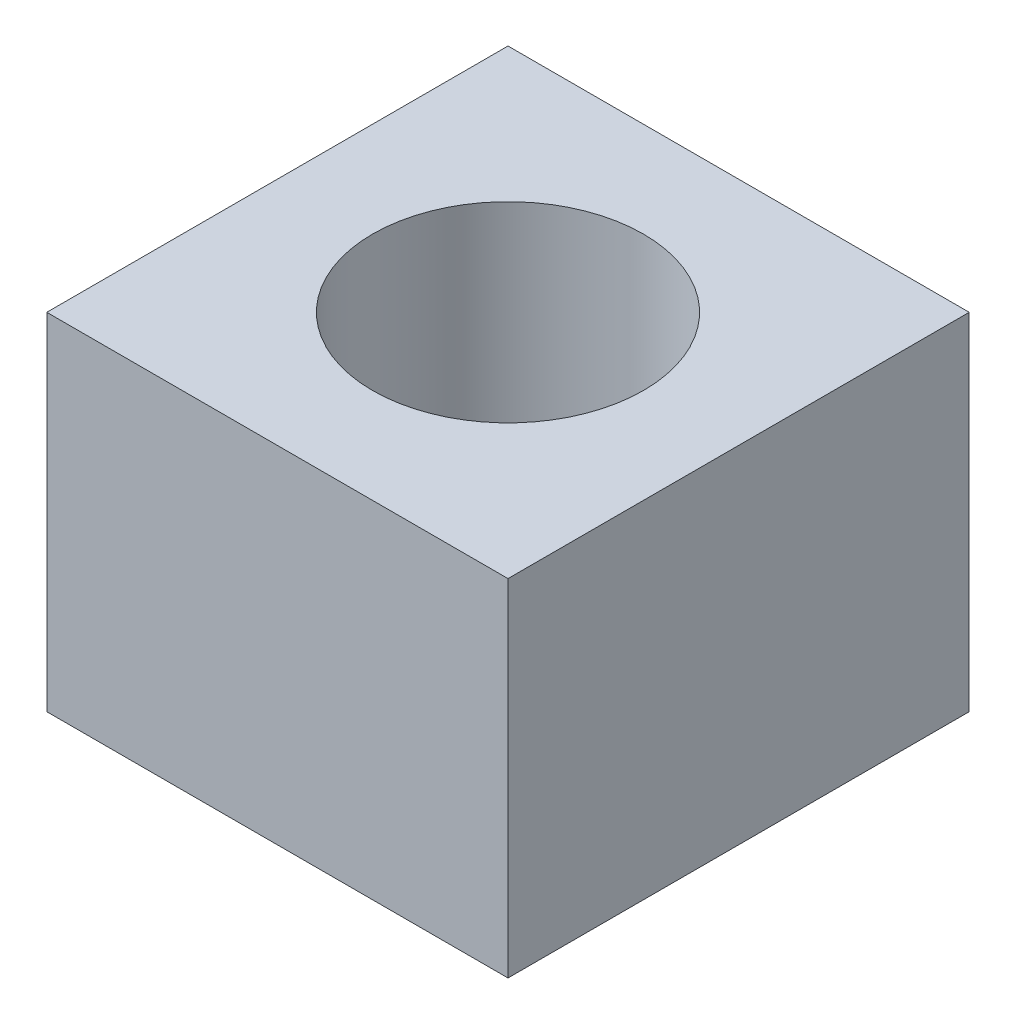
from build123d import *

# Parameters (mm, degrees)
SKETCH1_W           = 80
SKETCH1_H           = 80
BOSS_EXTRUDE1_DEPTH = 60
SKETCH2_R           = 23.5
CUT_EXTRUDE1_DEPTH  = 44.2


with BuildPart() as part:
    # Sketch1 → Boss-Extrude1 (new body)
    with BuildSketch(Plane(origin=(0, 0, 0), x_dir=(1, 0, 0), z_dir=(0, 1, 0))):
        Rectangle(SKETCH1_W, SKETCH1_H)
    extrude(amount=BOSS_EXTRUDE1_DEPTH)

    # Sketch2 → Cut-Extrude1 (cut)
    with BuildSketch(Plane(origin=(0, 60, 0), x_dir=(1, 0, 0), z_dir=(0, 1, 0))):
        with Locations(Location((0, 0, 0), (0, 0, 270))):
            Circle(SKETCH2_R)
    extrude(amount=-CUT_EXTRUDE1_DEPTH, mode=Mode.SUBTRACT)


solid = part.part
